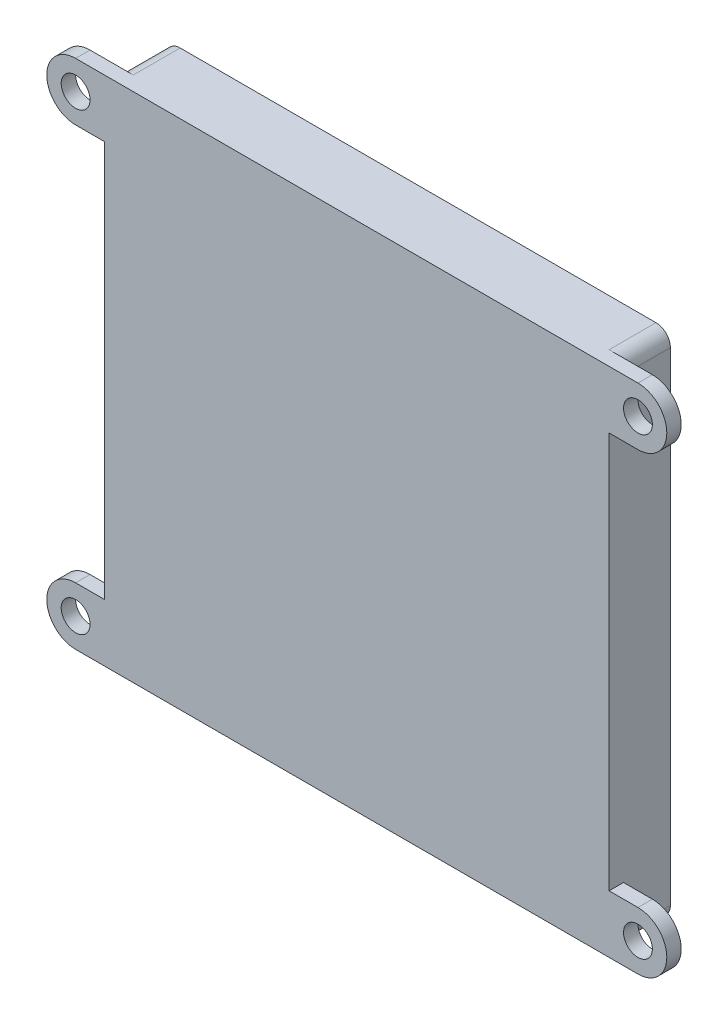
from build123d import *

# Parameters (mm, degrees)
SKETCH1_W           = 70
SKETCH1_H           = 55
SKETCH1_R           = 2
BOSS_EXTRUDE1_DEPTH = 2
SKETCH2_W           = 70
SKETCH2_H           = 71
BOSS_EXTRUDE2_DEPTH = 6.5
FILLET1_R           = 2


with BuildPart() as part:
    # Sketch1 → Boss-Extrude1 (new body)
    # profile 1 of 3: a face of its own
    with BuildSketch(Plane.XY):
        Rectangle(SKETCH1_W, SKETCH1_H)
    # profile 2 of 3: a face of its own
    with BuildSketch(Plane.XY):
        with BuildLine():
            Line((-39, 27.5), (39, 27.5))
            ThreePointArc((39, 27.5), (43, 31.5), (39, 35.5))
            Line((39, 35.5), (-39, 35.5))
            ThreePointArc((-39, 35.5), (-43, 31.5), (-39, 27.5))
        make_face()
        with Locations((-39, 31.5)):
            Circle(SKETCH1_R, mode=Mode.SUBTRACT)
        with Locations((39, 31.5)):
            Circle(SKETCH1_R, mode=Mode.SUBTRACT)
    # profile 3 of 3: a face of its own
    with BuildSketch(Plane.XY):
        with BuildLine():
            ThreePointArc((39, -27.5), (43, -31.5), (39, -35.5))
            Line((39, -35.5), (-39, -35.5))
            ThreePointArc((-39, -35.5), (-43, -31.5), (-39, -27.5))
            Line((-39, -27.5), (39, -27.5))
        make_face()
        with Locations((-39, -31.5)):
            Circle(SKETCH1_R, mode=Mode.SUBTRACT)
        with Locations((39, -31.5)):
            Circle(SKETCH1_R, mode=Mode.SUBTRACT)
    extrude(amount=BOSS_EXTRUDE1_DEPTH)

    # Sketch2 → Boss-Extrude2 (add)
    with BuildSketch(Plane.XY):
        Rectangle(SKETCH2_W, SKETCH2_H)
    extrude(amount=-BOSS_EXTRUDE2_DEPTH)

    # Fillet1
    fillet1_edges = [part.edges().sort_by_distance(p)[0] for p in [
        (35, 35.5, -3.25),
        (35, -35.5, -3.25),
        (-35, -35.5, -3.25),
        (-35, 35.5, -3.25),
    ]]
    fillet(fillet1_edges, radius=FILLET1_R)


solid = part.part
